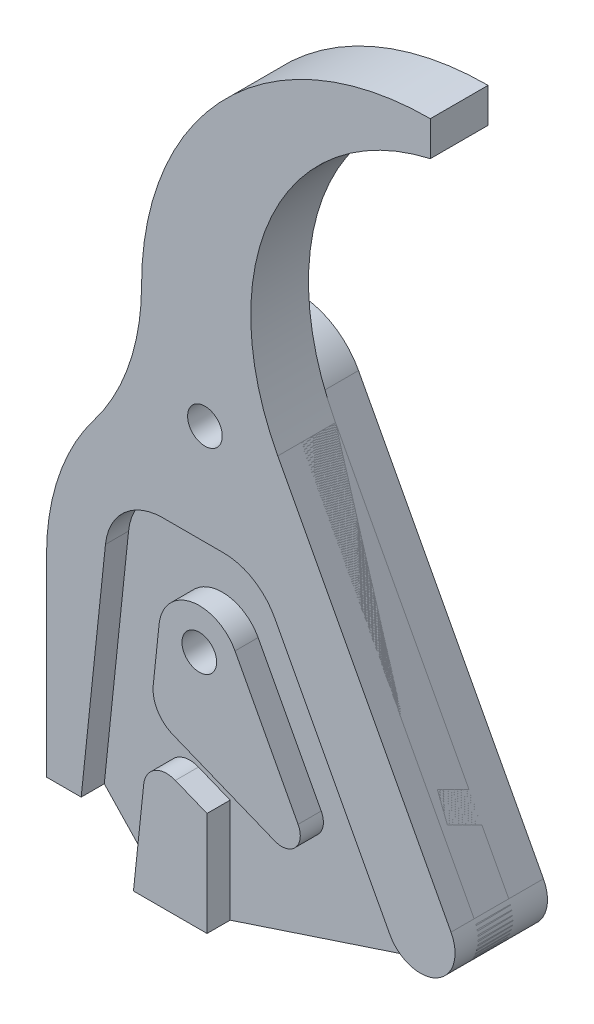
from build123d import *

# Parameters (mm, degrees)
CROQUIS4_R                = 1.5
SALIENTE_EXTRUIR1_DEPTH   = 5
SALIENTE_EXTRUIR1_2_DEPTH = 5
SALIENTE_EXTRUIR1_3_DEPTH = 5
SALIENTE_EXTRUIR2_START   = -3
CROQUIS5_R                = 1.5
SALIENTE_EXTRUIR2_DEPTH   = 3
CROQUIS6_R                = 1.5
SALIENTE_EXTRUIR3_DEPTH   = 3


with BuildPart() as part:
    # Croquis4 → Saliente-Extruir1 (new body)
    with BuildSketch(Plane.XY):
        with BuildLine():
            Line((31.332082611, 76.5), (31.332082611, 73.5))
            ThreePointArc((31.332082611, 73.5), (17.593960897, 62.317888205), (18.123970441, 44.612106598))
            Line((18.123970441, 44.612106598), (33.120139436, 16.408414688))
            ThreePointArc((33.120139436, 16.408414688), (31.879711346, 12.351157221), (27.822453879, 13.591585312))
            Line((27.822453879, 13.591585312), (17.849832742, 32.347357814))
            ThreePointArc((17.849832742, 32.347357814), (16.010285152, 34.285836504), (13.435094777, 35))
            Line((13.435094777, 35), (8.180668456, 35))
            ThreePointArc((8.180668456, 35), (4.835015424, 33.715724127), (3.208058979, 30.522642316))
            Line((3.208058979, 30.522642316), (1.105974274, 10.522642316))
            Line((1.105974274, 10.522642316), (-1.894025726, 10.522642316))
            Line((-1.894025726, 10.522642316), (-1.894025726, 27.20144431))
            ThreePointArc((-1.894025726, 27.20144431), (-0.837875871, 33.61475404), (2.219028442, 39.350722155))
            ThreePointArc((2.219028442, 39.350722155), (5.275932756, 45.086690271), (6.332082611, 51.5))
            ThreePointArc((6.332082611, 51.5), (13.654413081, 69.17766953), (31.332082611, 76.5))
        make_face()
        with Locations((11.817302712, 43.692896695)):
            Circle(CROQUIS4_R, mode=Mode.SUBTRACT)
    extrude(amount=SALIENTE_EXTRUIR1_DEPTH)



with BuildPart() as body_2:
    # Croquis4 → Saliente-Extruir1 2 (new body)
    with BuildSketch(Plane.XY):
        with BuildLine():
            Line((7.851255977, 26.865849621), (7.341304596, 22.013986331))
            ThreePointArc((7.341304596, 22.013986331), (7.719149951, 20.309636075), (9.046614258, 19.17587445))
            Line((9.046614258, 19.17587445), (17.853810231, 15.617536301))
            ThreePointArc((17.853810231, 15.617536301), (19.658030518, 16.034073375), (19.883693385, 17.871949935))
            Line((19.883693385, 17.871949935), (14.422399186, 28.14315047))
            ThreePointArc((14.422399186, 28.14315047), (10.664251127, 29.935695142), (7.851255977, 26.865849621))
        make_face()
        with Locations((11.332082611, 26.5)):
            Circle(CROQUIS4_R, mode=Mode.SUBTRACT)
    extrude(amount=SALIENTE_EXTRUIR1_2_DEPTH)


with BuildPart() as body_3:
    # Croquis4 → Saliente-Extruir1 3 (new body)
    with BuildSketch(Plane.XY):
        with BuildLine():
            Line((6.52097346, 14.209056927), (5.631578058, 5.747024927))
            Line((5.631578058, 5.747024927), (12, 5.747024927))
            Line((12, 5.747024927), (12, 14.747024927))
            Line((12, 14.747024927), (9.259230437, 15.854367709))
            ThreePointArc((9.259230437, 15.854367709), (7.479941101, 15.714334601), (6.52097346, 14.209056927))
        make_face()
    extrude(amount=SALIENTE_EXTRUIR1_3_DEPTH)


with BuildPart() as part_1:
    add(part.part)

    add(body_2.part)  # Saliente-Extruir2 merges body 2

    add(body_3.part)  # Saliente-Extruir2 merges body 3
    # Croquis5 → Saliente-Extruir2 (add)
    with BuildSketch(Plane.XY.offset(SALIENTE_EXTRUIR2_START)):
        with BuildLine():
            Line((12, 5.747024927), (31.411206338, 12.151040577))
            ThreePointArc((31.411206338, 12.151040577), (33.255375434, 13.882455653), (33.120139436, 16.408414688))
            Line((33.120139436, 16.408414688), (17.114988269, 46.509726071))
            ThreePointArc((17.114988269, 46.509726071), (11.909057427, 49.692195076), (6.608237363, 46.670418851))
            Line((6.608237363, 46.670418851), (3.695633773, 41.574926144))
            ThreePointArc((3.695633773, 41.574926144), (2.994485151, 40.43815831), (2.219028442, 39.350722155))
            ThreePointArc((2.219028442, 39.350722155), (-0.837875871, 33.61475404), (-1.894025726, 27.20144431))
            Line((-1.894025726, 27.20144431), (-1.894025726, 10.522642316))
            Line((-1.894025726, 10.522642316), (1.105974274, 10.522642316))
            Line((1.105974274, 10.522642316), (5.631578058, 5.747024927))
            Line((5.631578058, 5.747024927), (12, 5.747024927))
        make_face()
        with Locations((11.332082611, 26.5)):
            Circle(CROQUIS5_R, mode=Mode.SUBTRACT)
        with Locations((11.817302712, 43.692896695)):
            Circle(CROQUIS5_R, mode=Mode.SUBTRACT)
    extrude(amount=SALIENTE_EXTRUIR2_DEPTH)


with BuildPart() as body_2_2:
    # Croquis6 → Saliente-Extruir3 (new body)
    with BuildSketch(Plane.XY):
        with BuildLine():
            Line((33.120139436, 16.408414688), (17.114988269, 46.509726071))
            ThreePointArc((17.114988269, 46.509726071), (11.909057427, 49.692195076), (6.608237363, 46.670418851))
            Line((6.608237363, 46.670418851), (3.695633773, 41.574926144))
            ThreePointArc((3.695633773, 41.574926144), (2.994485151, 40.43815831), (2.219028442, 39.350722155))
            ThreePointArc((2.219028442, 39.350722155), (-0.837875871, 33.61475404), (-1.894025726, 27.20144431))
            Line((-1.894025726, 27.20144431), (-1.894025726, 10.522642316))
            Line((-1.894025726, 10.522642316), (1.105974274, 10.522642316))
            Line((1.105974274, 10.522642316), (5.631578058, 5.747024927))
            Line((5.631578058, 5.747024927), (12, 5.747024927))
            Line((12, 5.747024927), (31.411206338, 12.151040577))
            ThreePointArc((31.411206338, 12.151040577), (33.255375434, 13.882455653), (33.120139436, 16.408414688))
        make_face()
        with Locations((11.817302712, 43.692896695)):
            Circle(CROQUIS6_R, mode=Mode.SUBTRACT)
        with Locations((11.332082611, 26.5)):
            Circle(CROQUIS6_R, mode=Mode.SUBTRACT)
    extrude(amount=SALIENTE_EXTRUIR3_DEPTH)


solid = Compound([part_1.part, body_2_2.part])
